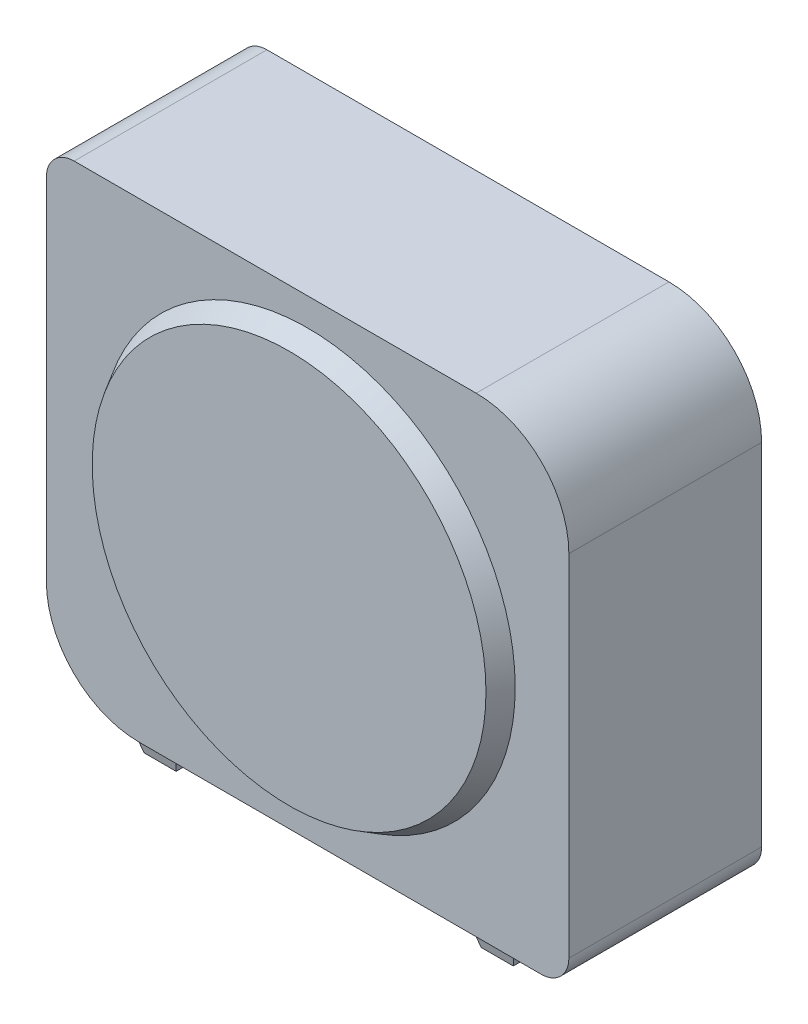
from build123d import *

# Parameters (mm, degrees)
SKETCH1_W                     = 281.9
SKETCH1_H                     = 254
BOSS_EXTRUDE1_DEPTH           = 104
SKETCH3_R                     = 112
BOSS_EXTRUDE3_DEPTH           = 10
BOSS_EXTRUDE3_TAPER           = 30
SKETCH5_R                     = 112
BOSS_EXTRUDE5_DEPTH           = 10
BOSS_EXTRUDE5_TAPER           = 30
FILLET5_R                     = 50
FILLET7_R                     = 15
FILLET8_R                     = 15
FILLET9_R                     = 50
SKETCH6_W                     = 20
SKETCH6_H                     = 104
BOSS_EXTRUDE7_DEPTH           = 5
BOSS_EXTRUDE7_DRAFT           = 15
BOSS_EXTRUDE7_PROFILE_2_DEPTH = 5
BOSS_EXTRUDE7_PROFILE_2_DRAFT = 15


with BuildPart() as part:
    # Sketch1 → Boss-Extrude1 (new body)
    with BuildSketch(Plane.XY):
        with Locations((140.95, 127)):
            Rectangle(SKETCH1_W, SKETCH1_H)
    extrude(amount=BOSS_EXTRUDE1_DEPTH)

    # Sketch3 → Boss-Extrude3 (add)
    with BuildSketch(Plane.XY.offset(104)):
        with Locations((140.95, 127)):
            Circle(SKETCH3_R)
    extrude(amount=BOSS_EXTRUDE3_DEPTH, taper=BOSS_EXTRUDE3_TAPER)

    # Sketch5 → Boss-Extrude5 (add)
    with BuildSketch(Plane(origin=(0, 0, 0), x_dir=(-1, 0, 0), z_dir=(0, 0, -1))):
        with Locations((-140.95, 127)):
            Circle(SKETCH5_R)
    extrude(amount=BOSS_EXTRUDE5_DEPTH, taper=BOSS_EXTRUDE5_TAPER)

    # Fillet5
    fillet5_edges = [part.edges().sort_by_distance(p)[0] for p in [
        (281.9, 254, 52),
    ]]
    fillet(fillet5_edges, radius=FILLET5_R)

    # Fillet7
    fillet7_edges = [part.edges().sort_by_distance(p)[0] for p in [
        (0, 254, 52),
    ]]
    fillet(fillet7_edges, radius=FILLET7_R)

    # Fillet8
    fillet8_edges = [part.edges().sort_by_distance(p)[0] for p in [
        (281.9, 0, 52),
    ]]
    fillet(fillet8_edges, radius=FILLET8_R)

    # Fillet9
    fillet9_edges = [part.edges().sort_by_distance(p)[0] for p in [
        (0, 0, 52),
    ]]
    fillet(fillet9_edges, radius=FILLET9_R)


with BuildPart() as boss_extrude7_tool:
    # Sketch6 → Boss-Extrude7 (with draft: the straight prism first)
    with BuildSketch(Plane.XZ):
        with Locations((241.9, 52)):
            Rectangle(SKETCH6_W, SKETCH6_H)
    extrude(amount=BOSS_EXTRUDE7_DEPTH)
    # Boss-Extrude7: the draft: its side faces are tilted about the plane it starts from
    boss_extrude7_sides = [boss_extrude7_tool.faces().sort_by_distance(p)[0] for p in [
        (241.9, -2.5, 104),
        (231.9, -2.5, 52),
        (241.9, -2.5, 0),
        (251.9, -2.5, 52),
    ]]
    draft(boss_extrude7_sides, Plane.XZ, BOSS_EXTRUDE7_DRAFT)


with BuildPart() as part_1:
    add(part.part)

    # Boss-Extrude7: add boss_extrude7_tool
    add(boss_extrude7_tool.part)


with BuildPart() as boss_extrude7_profile_2_tool:
    # Sketch6 → Boss-Extrude7 profile 2 (with draft: the straight prism first)
    with BuildSketch(Plane.XZ):
        with Locations((60, 52)):
            Rectangle(SKETCH6_W, SKETCH6_H)
    extrude(amount=BOSS_EXTRUDE7_PROFILE_2_DEPTH)
    # Boss-Extrude7 profile 2: the draft: its side faces are tilted about the plane it starts from
    boss_extrude7_profile_2_sides = [boss_extrude7_profile_2_tool.faces().sort_by_distance(p)[0] for p in [
        (50, -2.5, 52),
        (60, -2.5, 0),
        (70, -2.5, 52),
        (60, -2.5, 104),
    ]]
    draft(boss_extrude7_profile_2_sides, Plane.XZ, BOSS_EXTRUDE7_PROFILE_2_DRAFT)


with BuildPart() as part_2:
    add(part_1.part)

    # Boss-Extrude7 profile 2: add boss_extrude7_profile_2_tool
    add(boss_extrude7_profile_2_tool.part)


solid = part_2.part
